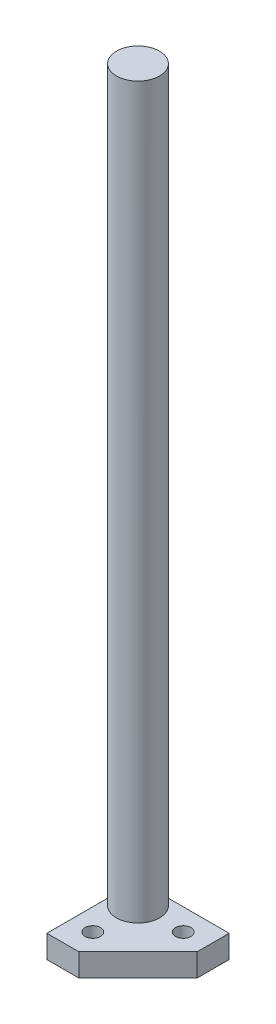
from build123d import *

# Parameters (mm, degrees)
SKETCH1_R           = 3
BOSS_EXTRUDE1_DEPTH = 101.6
BOSS_EXTRUDE2_START = 3.175
SKETCH3_R           = 1.0795
BOSS_EXTRUDE2_DEPTH = 3.175


with BuildPart() as part:
    # Sketch1 → Boss-Extrude1 (new body)
    with BuildSketch(Plane(origin=(0, 0, 0), x_dir=(1, 0, 0), z_dir=(0, 1, 0))):
        with Locations(Location((0, 0, 0), (0, 0, 270))):
            Circle(SKETCH1_R)
    extrude(amount=BOSS_EXTRUDE1_DEPTH)

    # Sketch3 → Boss-Extrude2 (add)
    with BuildSketch(Plane.XZ.offset(BOSS_EXTRUDE2_START)):
        with BuildLine():
            Line((-3, 0), (-3, 9.7))
            Line((-3, 9.7), (1.445, 9.7))
            Line((1.445, 9.7), (9.7, 1.445))
            Line((9.7, 1.445), (9.7, -3))
            Line((9.7, -3), (0, -3))
            ThreePointArc((0, -3), (-2.121320344, -2.121320344), (-3, 0))
        make_face()
        with Locations(Location((0.048, 6.34981858, 0), (0, 0, 270))):
            Circle(SKETCH3_R, mode=Mode.SUBTRACT)
        with Locations(Location((6.34981858, 0.048, 0), (0, 0, 270))):
            Circle(SKETCH3_R, mode=Mode.SUBTRACT)
    extrude(amount=-BOSS_EXTRUDE2_DEPTH)


solid = part.part
